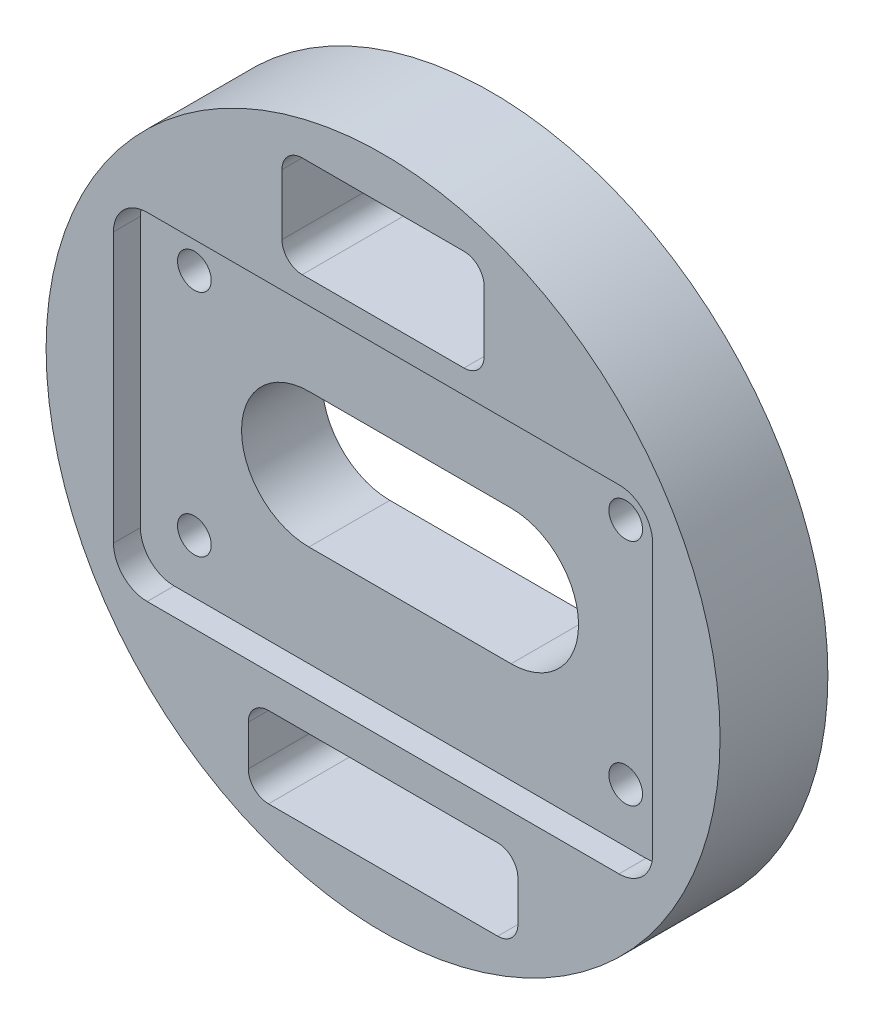
from build123d import *

# Parameters (mm, degrees)
SKETCH1_R             = 25
BOSS_EXTRUDE1_DEPTH   = 8
CUT_EXTRUDE1_DEPTH    = 2
CUT_EXTRUDE2_DEPTH    = 36.860842154
M3X0_5_TAPPED_HOLE1_D = 2.5
CUT_EXTRUDE3_DEPTH    = 37.249137921
SKETCH7_W             = 20
SKETCH7_H             = 6
CUT_EXTRUDE4_DEPTH    = 37.249137921
FILLET1_R             = 1.5


with BuildPart() as part:
    # Sketch1 → Boss-Extrude1 (new body)
    with BuildSketch(Plane.XY):
        Circle(SKETCH1_R)
    extrude(amount=-BOSS_EXTRUDE1_DEPTH)

    # Sketch2 → Cut-Extrude1 (cut)
    with BuildSketch(Plane.XY):
        with BuildLine():
            Line((-17.5, 12.5), (17.5, 12.5))
            ThreePointArc((17.5, 12.5), (19.267766953, 11.767766953), (20, 10))
            Line((20, 10), (20, -10))
            ThreePointArc((20, -10), (19.267766953, -11.767766953), (17.5, -12.5))
            Line((17.5, -12.5), (-17.5, -12.5))
            ThreePointArc((-17.5, -12.5), (-19.267766953, -11.767766953), (-20, -10))
            Line((-20, -10), (-20, 10))
            ThreePointArc((-20, 10), (-19.267766953, 11.767766953), (-17.5, 12.5))
        make_face()
    extrude(amount=-CUT_EXTRUDE1_DEPTH, mode=Mode.SUBTRACT)

    # Sketch3 → Cut-Extrude2 (cut, through all)
    with BuildSketch(Plane.XY.offset(-2)):
        with BuildLine():
            Line((-7.5, 5), (7.5, 5))
            ThreePointArc((7.5, 5), (12.5, 0), (7.5, -5))
            Line((7.5, -5), (-7.5, -5))
            ThreePointArc((-7.5, -5), (-12.5, 0), (-7.5, 5))
        make_face()
    extrude(amount=-CUT_EXTRUDE2_DEPTH, mode=Mode.SUBTRACT)

    # M3x0.5 Tapped Hole1 (through all)
    with Locations(Plane.XY.offset(-2)):
        with Locations((16, 8.5), (-16, 8.5), (-16, -8.5), (16, -8.5)):
            Hole(M3X0_5_TAPPED_HOLE1_D / 2)

    # Sketch6 → Cut-Extrude3 (cut, through all)
    with BuildSketch(Plane.XY):
        with BuildLine():
            Line((6, 21.75), (-6, 21.75))
            ThreePointArc((-6, 21.75), (-7.060660172, 21.310660172), (-7.5, 20.25))
            Line((-7.5, 20.25), (-7.5, 15.75))
            ThreePointArc((-7.5, 15.75), (-7.060660172, 14.689339828), (-6, 14.25))
            Line((-6, 14.25), (6, 14.25))
            ThreePointArc((6, 14.25), (7.060660172, 14.689339828), (7.5, 15.75))
            Line((7.5, 15.75), (7.5, 20.25))
            ThreePointArc((7.5, 20.25), (7.060660172, 21.310660172), (6, 21.75))
        make_face()
    extrude(amount=-CUT_EXTRUDE3_DEPTH, mode=Mode.SUBTRACT)

    # Sketch7 → Cut-Extrude4 (cut, through all)
    with BuildSketch(Plane.XY):
        with Locations((0, -18)):
            Rectangle(SKETCH7_W, SKETCH7_H)
    extrude(amount=-CUT_EXTRUDE4_DEPTH, mode=Mode.SUBTRACT)

    # Fillet1
    fillet1_edges = [part.edges().sort_by_distance(p)[0] for p in [
        (10, -15, -4),
        (10, -21, -4),
        (-10, -21, -4),
        (-10, -15, -4),
    ]]
    fillet(fillet1_edges, radius=FILLET1_R)


solid = part.part
